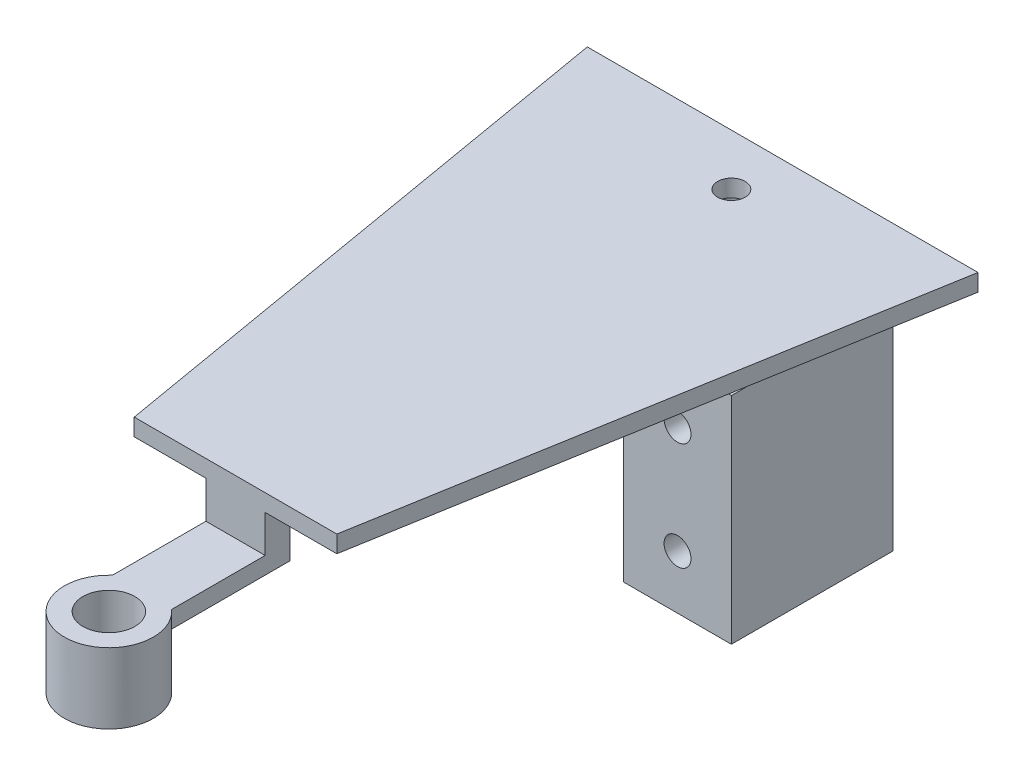
from build123d import *

# Parameters (mm, degrees)
SKETCH1_W           = 20
SKETCH1_H           = 40
SKETCH1_R           = 2.5
BOSS_EXTRUDE1_DEPTH = 30
SKETCH3_R           = 9.525
BOSS_EXTRUDE2_DEPTH = 20
SKETCH5_R           = 3.175
CUT_EXTRUDE1_DEPTH  = 20
SKETCH4_R           = 4.826
BOSS_EXTRUDE3_DEPTH = 3.175
SKETCH7_R           = 8.255
SKETCH7_R_2         = 4.826
BOSS_EXTRUDE5_DEPTH = 13.081
SKETCH9_W           = 11
SKETCH9_H           = 22
BOSS_EXTRUDE6_DEPTH = 3.175
SKETCH10_W          = 11
SKETCH10_H          = 4.630893518
BOSS_EXTRUDE7_DEPTH = 6.919
SKETCH13_R          = 2.5527
CUT_EXTRUDE5_DEPTH  = 3.175


with BuildPart() as part:
    # Sketch1 → Boss-Extrude1 (new body)
    with BuildSketch(Plane.XY):
        with Locations((10, 20)):
            Rectangle(SKETCH1_W, SKETCH1_H)
        with Locations((10, 30)):
            Circle(SKETCH1_R, mode=Mode.SUBTRACT)
        with Locations((10, 10)):
            Circle(SKETCH1_R, mode=Mode.SUBTRACT)
    extrude(amount=-BOSS_EXTRUDE1_DEPTH)

    # Sketch3 → Boss-Extrude2 (add)
    with BuildSketch(Plane(origin=(0, 40, 0), x_dir=(1, 0, 0), z_dir=(0, 1, 0))):
        with Locations(Location((10, 10, 0), (0, 0, 270))):
            Circle(SKETCH3_R)
    extrude(amount=BOSS_EXTRUDE2_DEPTH)

    # Sketch5 → Cut-Extrude1 (cut)
    with BuildSketch(Plane(origin=(0, 60, 0), x_dir=(1, 0, 0), z_dir=(0, 1, 0))):
        with Locations(Location((10, 10, 0), (0, 0, 270))):
            Circle(SKETCH5_R)
    extrude(amount=-CUT_EXTRUDE1_DEPTH, mode=Mode.SUBTRACT)


with BuildPart() as body_2:
    # Sketch4 → Boss-Extrude3 (new body)
    # profile 1 of 2: a face of its own
    with BuildSketch(Plane(origin=(0, 60, 0), x_dir=(1, 0, 0), z_dir=(0, 1, 0))):
        Polygon((46.273751225, 19.525), (28.810402961, -82.075), (-8.810402961, -82.075), (-26.273751225, 19.525), align=None)
        with Locations((10, -73.185)):
            Circle(SKETCH4_R, mode=Mode.SUBTRACT)
    # profile 2 of 2: a face of its own
    with BuildSketch(Plane(origin=(0, 60, 0), x_dir=(1, 0, 0), z_dir=(0, 1, 0))):
        with Locations((10, -73.185)):
            Circle(SKETCH4_R)
    extrude(amount=BOSS_EXTRUDE3_DEPTH)


with BuildPart() as body_3:
    # Sketch7 → Boss-Extrude5 (new body)
    with BuildSketch(Plane(origin=(0, 40, 0), x_dir=(1, 0, 0), z_dir=(0, 1, 0))):
        with Locations(Location((10, -105.6, 0), (0, 0, 270))):
            Circle(SKETCH7_R)
        with Locations(Location((10, -105.6, 0), (0, 0, 270))):
            Circle(SKETCH7_R_2, mode=Mode.SUBTRACT)
    extrude(amount=BOSS_EXTRUDE5_DEPTH)

    # Sketch9 → Boss-Extrude6 (add)
    with BuildSketch(Plane(origin=(0, 53.081, 0), x_dir=(1, 0, 0), z_dir=(0, 1, 0))):
        with Locations((10, -88.444106482)):
            Rectangle(SKETCH9_W, SKETCH9_H)
    extrude(amount=-BOSS_EXTRUDE6_DEPTH)

    # Sketch10 → Boss-Extrude7 (add)
    with BuildSketch(Plane(origin=(0, 53.081, 0), x_dir=(1, 0, 0), z_dir=(0, 1, 0))):
        with Locations((10, -79.759553241)):
            Rectangle(SKETCH10_W, SKETCH10_H)
    extrude(amount=BOSS_EXTRUDE7_DEPTH)

    # Combine1: union body 2
    add(body_2.part)

    # Sketch13 → Cut-Extrude5 (cut)
    with BuildSketch(Plane(origin=(0, 63.175, 0), x_dir=(1, 0, 0), z_dir=(0, 1, 0))):
        with Locations(Location((10, 10, 0), (0, 0, 270))):
            Circle(SKETCH13_R)
    extrude(amount=-CUT_EXTRUDE5_DEPTH, mode=Mode.SUBTRACT)


solid = Compound([part.part, body_3.part])
